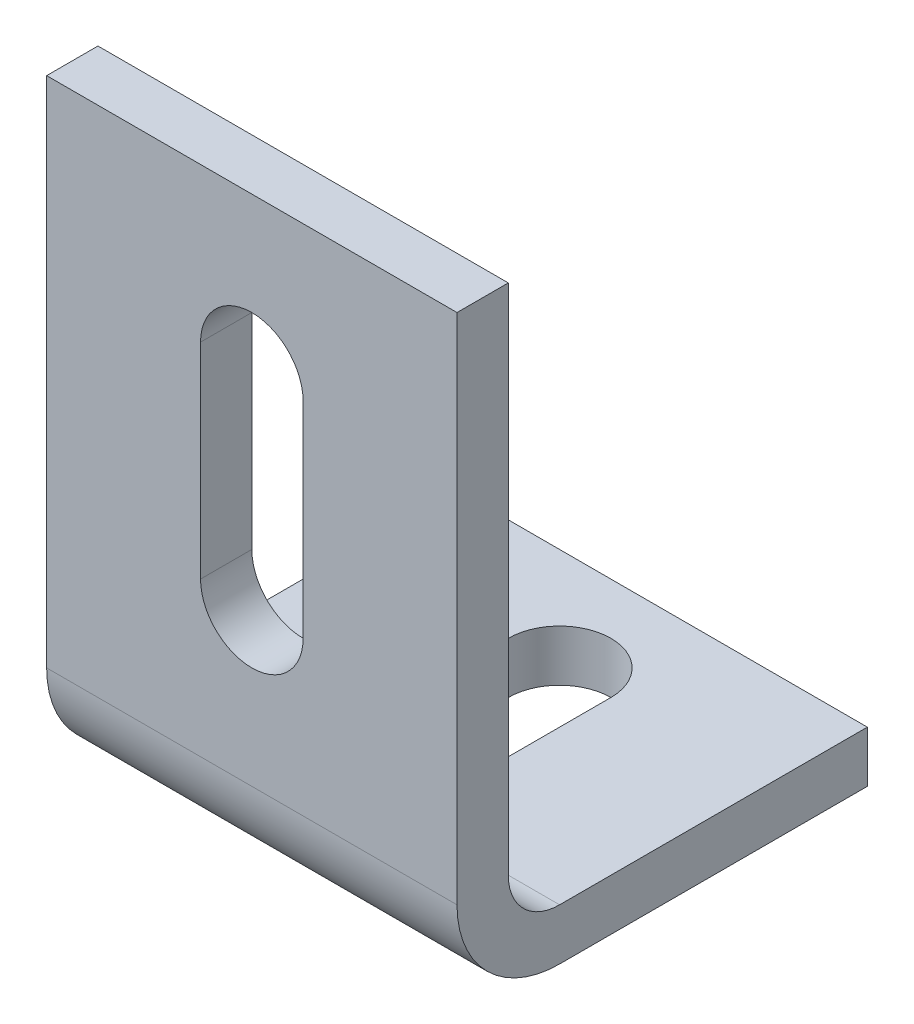
from build123d import *

# Parameters (mm, degrees)
EXTRUDE_THIN1_DEPTH = 12.7
CUT_EXTRUDE1_DEPTH  = 44.301226888
CUT_EXTRUDE2_DEPTH  = 44.301226888


with BuildPart() as part:
    # Sketch4 → Extrude-Thin1 (new, symmetric)
    with BuildSketch(Plane(origin=(0, 0, 0), x_dir=(0, 0, -1), z_dir=(1, 0, 0))):
        with BuildLine():
            Line((-3.175, 34.925), (-3.175, 3.175))
            ThreePointArc((-3.175, 3.175), (-1.315128061, -1.315128061), (3.175, -3.175))
            Line((3.175, -3.175), (22.225, -3.175))
            Line((22.225, -3.175), (22.225, 0))
            Line((22.225, 0), (3.175, 0))
            ThreePointArc((3.175, 0), (0.92993597, 0.92993597), (0, 3.175))
            Line((0, 3.175), (0, 34.925))
            Line((0, 34.925), (-3.175, 34.925))
        make_face()
    extrude(amount=EXTRUDE_THIN1_DEPTH, both=True)

    # Sketch5 → Cut-Extrude1 (cut, through all)
    with BuildSketch(Plane.XY):
        with BuildLine():
            Line((3.175, 25.4), (3.175, 12.7))
            ThreePointArc((3.175, 12.7), (0, 9.525), (-3.175, 12.7))
            Line((-3.175, 12.7), (-3.175, 25.4))
            ThreePointArc((-3.175, 25.4), (0, 28.575), (3.175, 25.4))
        make_face()
    extrude(amount=CUT_EXTRUDE1_DEPTH, mode=Mode.SUBTRACT)

    # Sketch6 → Cut-Extrude2 (cut, through all)
    with BuildSketch(Plane(origin=(0, 0, 0), x_dir=(1, 0, 0), z_dir=(0, 1, 0))):
        with BuildLine():
            Line((-3.175, 15.875), (-3.175, 9.525))
            ThreePointArc((-3.175, 9.525), (0, 6.35), (3.175, 9.525))
            Line((3.175, 9.525), (3.175, 15.875))
            ThreePointArc((3.175, 15.875), (0, 19.05), (-3.175, 15.875))
        make_face()
    extrude(amount=-CUT_EXTRUDE2_DEPTH, mode=Mode.SUBTRACT)


solid = part.part
